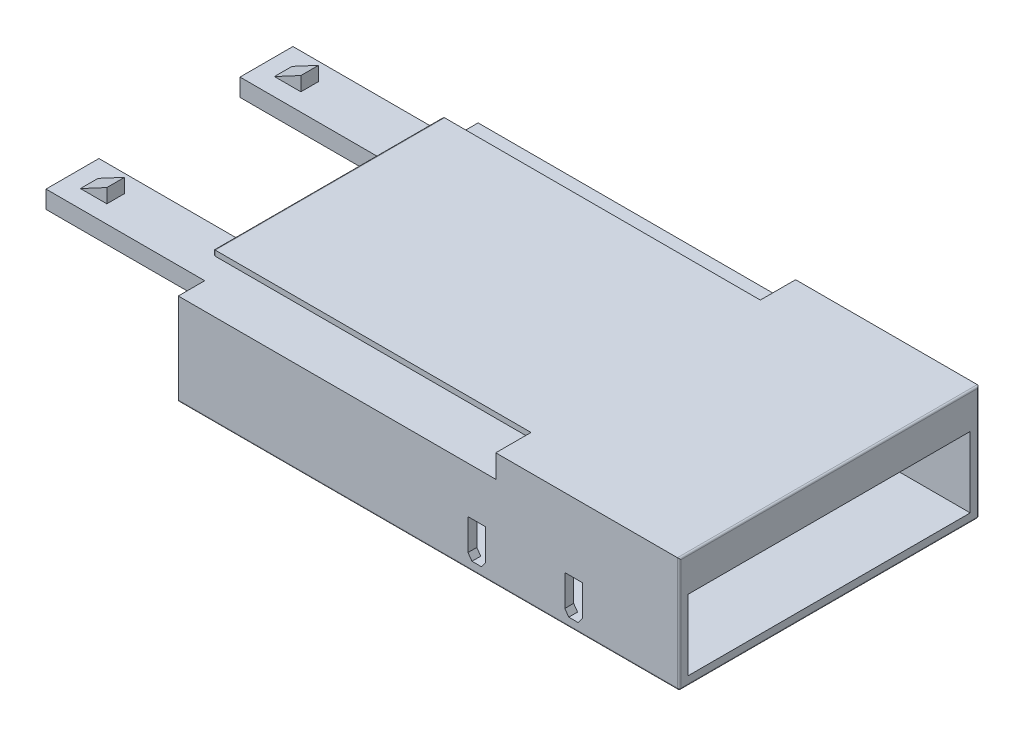
from build123d import *

# Parameters (mm, degrees)
SKETCH1_W           = 284
SKETCH1_H           = 170
BOSS_EXTRUDE1_DEPTH = 65
CUT_EXTRUDE1_DEPTH  = 180
SKETCH3_W           = 30
SKETCH3_H           = 10
BOSS_EXTRUDE2_DEPTH = 90
SKETCH4_W           = 15
SKETCH4_H           = 10
BOSS_EXTRUDE3_DEPTH = 8
CUT_EXTRUDE2_DEPTH  = 10
CUT_EXTRUDE3_DEPTH  = 10
CUT_EXTRUDE4_DEPTH  = 5
SKETCH8_W           = 160
SKETCH8_H           = 40
CUT_EXTRUDE5_DEPTH  = 279
CUT_EXTRUDE6_DEPTH  = 5
SKETCH10_R          = 5
CUT_EXTRUDE7_DEPTH  = 5
FILLET1_R           = 1
FILLET2_R           = 1


with BuildPart() as part:
    # Sketch1 → Boss-Extrude1 (new body)
    with BuildSketch(Plane(origin=(0, 0, 0), x_dir=(1, 0, 0), z_dir=(0, 1, 0))):
        with Locations((142, 85)):
            Rectangle(SKETCH1_W, SKETCH1_H)
    extrude(amount=BOSS_EXTRUDE1_DEPTH)

    # Sketch2 → Cut-Extrude1 (cut)
    with BuildSketch(Plane.ZY):
        Polygon((-140, 52), (-170, 52), (-170, 65), (-150, 65), (-150, 62), (-140, 62), align=None)
        Polygon((-30, 52), (0, 52), (0, 65), (-20, 65), (-20, 62), (-30, 62), align=None)
    extrude(amount=-CUT_EXTRUDE1_DEPTH, mode=Mode.SUBTRACT)

    # Sketch3 → Boss-Extrude2 (add)
    with BuildSketch(Plane.ZY):
        with Locations((-140, 47)):
            Rectangle(SKETCH3_W, SKETCH3_H)
        with Locations((-30, 47)):
            Rectangle(SKETCH3_W, SKETCH3_H)
    extrude(amount=BOSS_EXTRUDE2_DEPTH)

    # Sketch4 → Boss-Extrude3 (add)
    with BuildSketch(Plane(origin=(0, 52, 0), x_dir=(1, 0, 0), z_dir=(0, 1, 0))):
        with Locations((-73, 140)):
            Rectangle(SKETCH4_W, SKETCH4_H)
        with Locations((-73, 30)):
            Rectangle(SKETCH4_W, SKETCH4_H)
    extrude(amount=BOSS_EXTRUDE3_DEPTH)

    # Sketch6 → Cut-Extrude2 (cut)
    with BuildSketch(Plane(origin=(0, 0, -145), x_dir=(-1, 0, 0), z_dir=(0, 0, -1))):
        Polygon((65.5, 60), (80.5, 52), (80.5, 60), align=None)
    extrude(amount=-CUT_EXTRUDE2_DEPTH, mode=Mode.SUBTRACT)

    # Sketch5 → Cut-Extrude3 (cut)
    with BuildSketch(Plane.XY.offset(-25)):
        Polygon((-65.5, 60), (-80.5, 52), (-80.5, 60), align=None)
    extrude(amount=-CUT_EXTRUDE3_DEPTH, mode=Mode.SUBTRACT)

    # Sketch7 → Cut-Extrude4 (cut)
    with BuildSketch(Plane.XZ):
        with BuildLine():
            Line((13.5, -37.5), (13.5, -132.5))
            ThreePointArc((13.5, -132.5), (11, -135), (8.5, -132.5))
            Line((8.5, -132.5), (8.5, -37.5))
            ThreePointArc((8.5, -37.5), (11, -35), (13.5, -37.5))
        make_face()
        with BuildLine():
            Line((58.5, -37.5), (58.5, -132.5))
            ThreePointArc((58.5, -132.5), (56, -135), (53.5, -132.5))
            Line((53.5, -132.5), (53.5, -37.5))
            ThreePointArc((53.5, -37.5), (56, -35), (58.5, -37.5))
        make_face()
        with BuildLine():
            Line((28.5, -37.5), (28.5, -132.5))
            ThreePointArc((28.5, -132.5), (26, -135), (23.5, -132.5))
            Line((23.5, -132.5), (23.5, -37.5))
            ThreePointArc((23.5, -37.5), (26, -35), (28.5, -37.5))
        make_face()
        with BuildLine():
            Line((43.5, -37.5), (43.5, -132.5))
            ThreePointArc((43.5, -132.5), (41, -135), (38.5, -132.5))
            Line((38.5, -132.5), (38.5, -37.5))
            ThreePointArc((38.5, -37.5), (41, -35), (43.5, -37.5))
        make_face()
    extrude(amount=-CUT_EXTRUDE4_DEPTH, mode=Mode.SUBTRACT)

    # Sketch8 → Cut-Extrude5 (cut)
    with BuildSketch(Plane(origin=(284, 0, 0), x_dir=(0, 0, -1), z_dir=(1, 0, 0))):
        with Locations((85, 25)):
            Rectangle(SKETCH8_W, SKETCH8_H)
    extrude(amount=-CUT_EXTRUDE5_DEPTH, mode=Mode.SUBTRACT)

    # Sketch9 → Cut-Extrude6 (cut)
    with BuildSketch(Plane.XY):
        Polygon((219.15, 25.8), (229.05, 25.8), (229.05, 8.15), (226.8, 5), (221.4, 5), (219.15, 8.15), align=None)
        Polygon((164.25, 25.8), (174.15, 25.8), (174.15, 8.15), (171.9, 5), (166.5, 5), (164.25, 8.15), align=None)
    extrude(amount=-CUT_EXTRUDE6_DEPTH, mode=Mode.SUBTRACT)

    # Sketch10 → Cut-Extrude7 (cut)
    with BuildSketch(Plane.ZY):
        with Locations((-129.202249563, 20)):
            Circle(SKETCH10_R)
        with Locations((-114.202249563, 20)):
            Circle(SKETCH10_R)
        with Locations((-99.202249563, 20)):
            Circle(SKETCH10_R)
        with Locations((-43.390057257, 20)):
            Circle(SKETCH10_R)
        with Locations((-58.390057257, 20)):
            Circle(SKETCH10_R)
        with Locations((-73.390057257, 20)):
            Circle(SKETCH10_R)
    extrude(amount=-CUT_EXTRUDE7_DEPTH, mode=Mode.SUBTRACT)

    # Fillet1
    fillet1_edges = [part.edges().sort_by_distance(p)[0] for p in [
        (0, 65, -85),
        (0, 63.5, -150),
        (0, 62, -145),
        (0, 62, -25),
        (0, 63.5, -20),
    ]]
    fillet(fillet1_edges, radius=FILLET1_R)

    # Fillet2
    fillet2_edges = [part.edges().sort_by_distance(p)[0] for p in [
        (284, 65, -85),
        (142, 0, -170),
        (284, 0, -85),
        (142, 0, 0),
        (0, 0, -85),
        (284, 32.5, -170),
        (284, 32.5, 0),
    ]]
    fillet(fillet2_edges, radius=FILLET2_R)


solid = part.part
